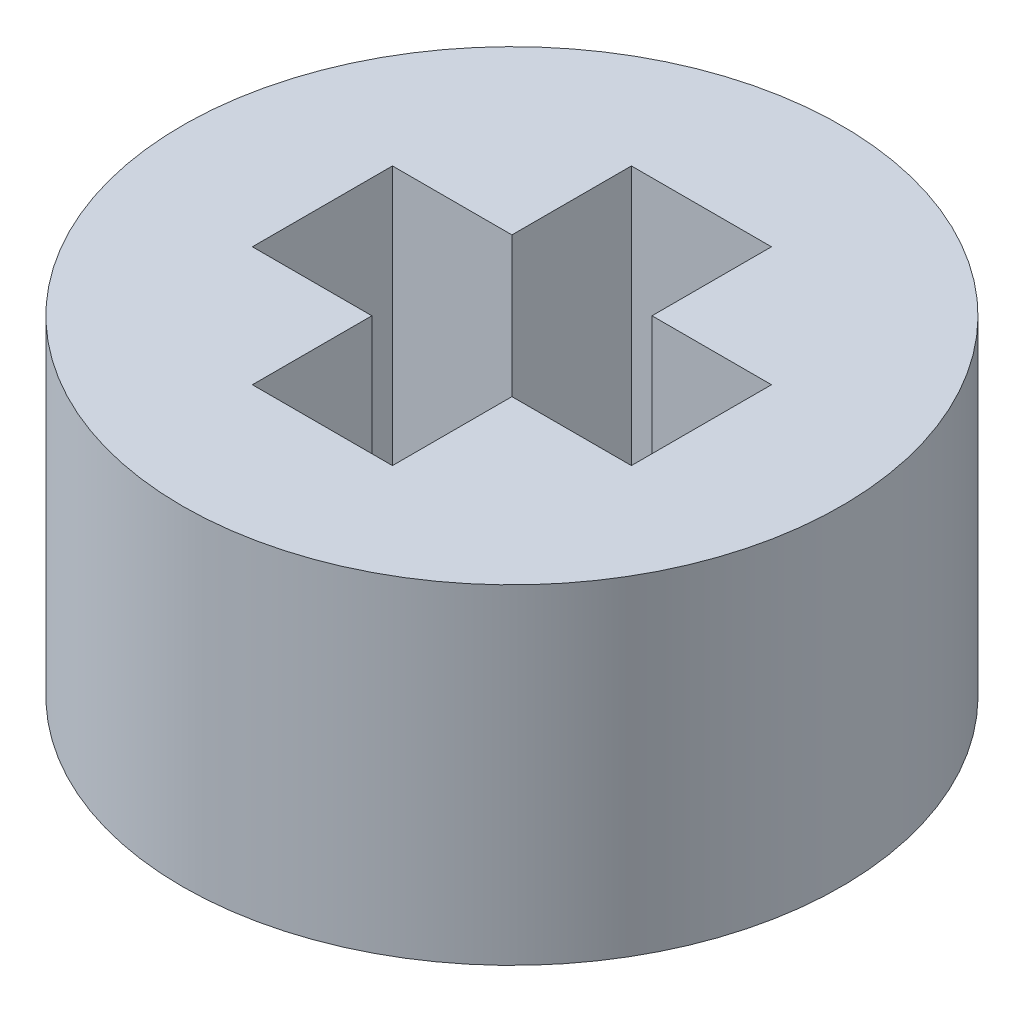
from build123d import *

# Parameters (mm, degrees)
SKETCH2_R           = 4
BOSS_EXTRUDE1_DEPTH = 4


with BuildPart() as part:
    # Sketch2 → Boss-Extrude1 (new body)
    with BuildSketch(Plane(origin=(0, 0, 0), x_dir=(1, 0, 0), z_dir=(0, 1, 0))):
        with Locations(Location((0, 0, 0), (0, 0, 270))):
            Circle(SKETCH2_R)
        Polygon((0.85, 0.85), (2.3, 0.85), (2.3, -0.85), (0.85, -0.85), (0.85, -2.3), (-0.85, -2.3), (-0.85, -0.85), (-2.3, -0.85), (-2.3, 0.85), (-0.85, 0.85), (-0.85, 2.3), (0.85, 2.3), align=None, mode=Mode.SUBTRACT)
    extrude(amount=BOSS_EXTRUDE1_DEPTH)


solid = part.part
